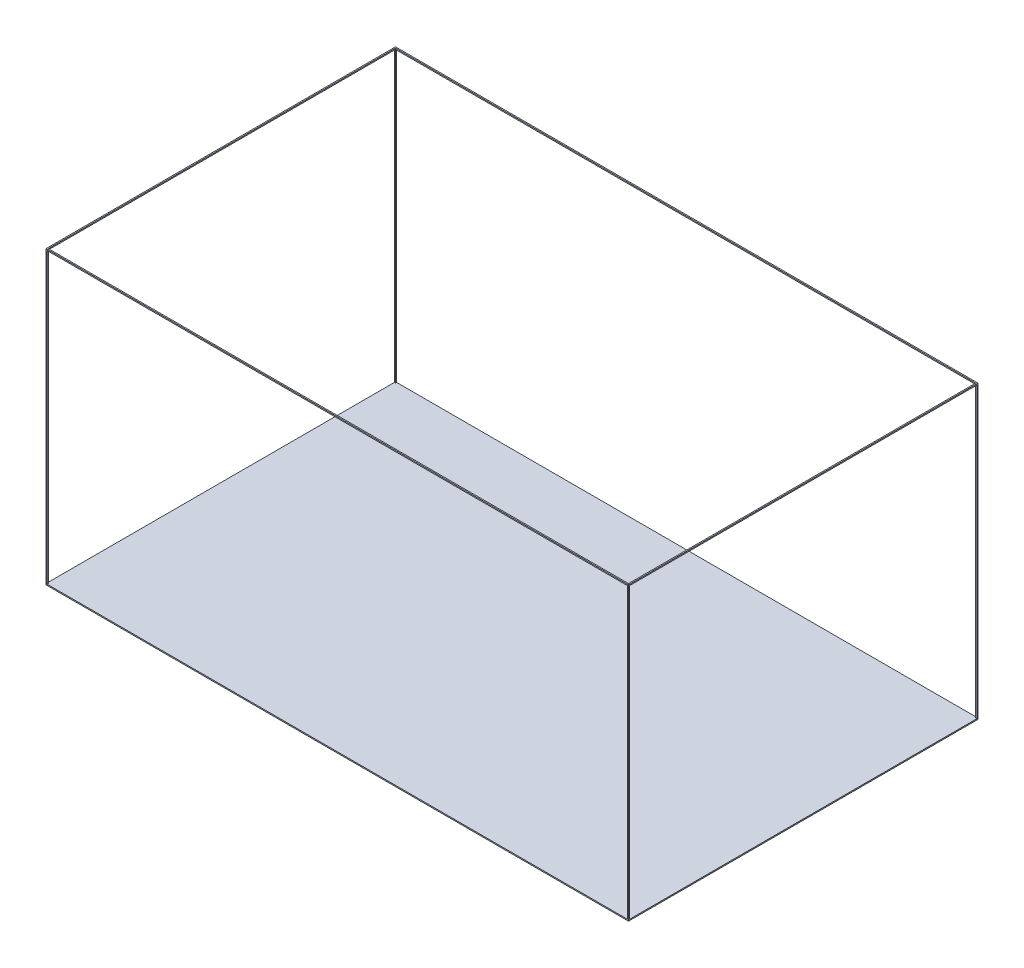
from build123d import *

# Parameters (mm, degrees)
SKETCH_1_W          = 5000
SKETCH_1_H          = 3000
EXTRUDE_1_DEPTH     = 2500
SHELL_1_T           = -10
SKETCH_4_W          = 4980
SKETCH_4_H          = 2480
CUT_EXTRUDE_5_DEPTH = 4637.809247748
SKETCH_5_W          = 2980
SKETCH_5_H          = 2480
CUT_EXTRUDE_6_DEPTH = 5788.918451395


with BuildPart() as part:
    # 草图1 → 凸台-拉伸1 (new body)
    with BuildSketch(Plane(origin=(0, 0, 0), x_dir=(1, 0, 0), z_dir=(0, 1, 0))):
        Rectangle(SKETCH_1_W, SKETCH_1_H)
    extrude(amount=EXTRUDE_1_DEPTH)

    # 抽壳1
    shell_1_openings = [part.faces().sort_by_distance(p)[0] for p in [
        (0, 2500, 0),
    ]]
    offset(amount=SHELL_1_T, openings=shell_1_openings, kind=Kind.INTERSECTION)

    # 草图4 → 切除-拉伸5 (cut, through all)
    with BuildSketch(Plane.XY.offset(1500)):
        with Locations((0, 1250)):
            Rectangle(SKETCH_4_W, SKETCH_4_H)
    extrude(amount=-CUT_EXTRUDE_5_DEPTH, mode=Mode.SUBTRACT)

    # 草图5 → 切除-拉伸6 (cut, through all)
    with BuildSketch(Plane(origin=(2500, 0, 0), x_dir=(0, 0, -1), z_dir=(1, 0, 0))):
        with Locations((0, 1250)):
            Rectangle(SKETCH_5_W, SKETCH_5_H)
    extrude(amount=-CUT_EXTRUDE_6_DEPTH, mode=Mode.SUBTRACT)


solid = part.part
